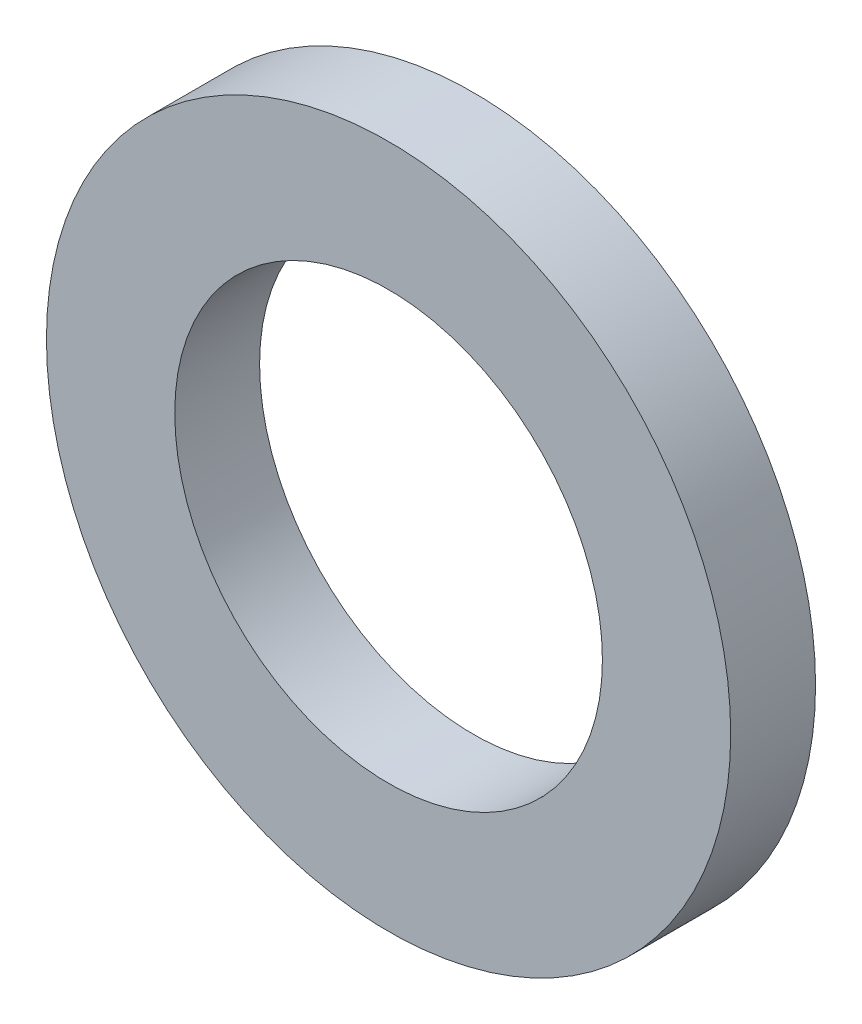
from build123d import *

# Parameters (mm, degrees)
SKETCH1_R      = 6.35
SKETCH1_R_2    = 3.96875
EXTRUDE1_DEPTH = 1.5748


with BuildPart() as part:
    # Sketch1 → Extrude1 (new body)
    with BuildSketch(Plane.XY):
        Circle(SKETCH1_R)
        Circle(SKETCH1_R_2, mode=Mode.SUBTRACT)
    extrude(amount=EXTRUDE1_DEPTH)


solid = part.part
